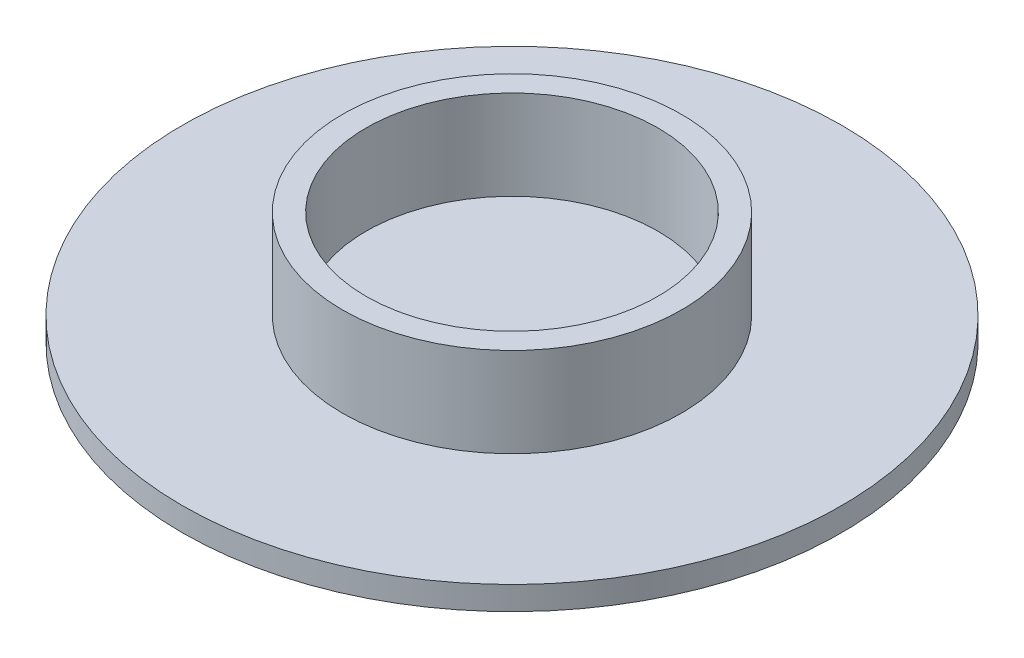
from build123d import *


with BuildPart() as part:
    # Sketch1 → Revolve1 (revolve)
    with BuildSketch(Plane(origin=(0, 0, 0), x_dir=(0, 0, -1), z_dir=(1, 0, 0)), mode=Mode.PRIVATE) as revolve1_sk:
        Polygon((0, 0), (70, 0), (70, 5), (36, 5), (36, 24), (31, 24), (31, 5), (0, 5), align=None)
    revolve(revolve1_sk.sketch.rotate(Axis((0, 5, 0), (0, -1, 0)), 180), axis=Axis((0, 5, 0), (0, -1, 0)))


solid = part.part
